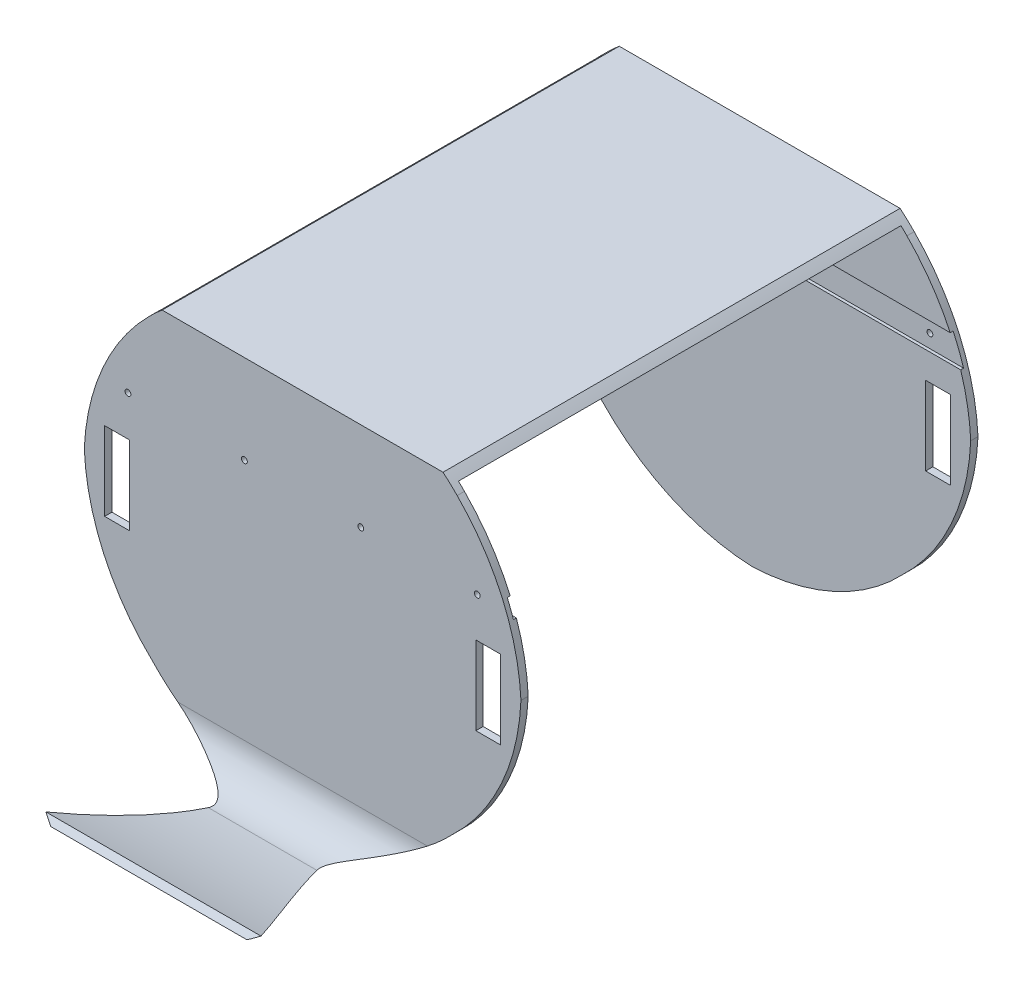
from build123d import *

# Parameters (mm, degrees)
BOSS_EXTRUDE1_DEPTH      = 150
BOSS_EXTRUDE1_DEPTH_BACK = 150
CUT_EXTRUDE1_DEPTH       = 399.19822728
CUT_EXTRUDE1_DEPTH_BACK  = 399.19822728
SKETCH2_OUTSIDE_W        = 417.444
SKETCH2_OUTSIDE_H        = 376.444
CUT_EXTRUDE2_DEPTH       = 399.198227346
CUT_EXTRUDE2_DEPTH_BACK  = 399.198227346
SKETCH3_W                = 4
SKETCH3_H                = 11
SKETCH3_H_2              = 18.5
CUT_EXTRUDE3_DEPTH       = 399.198227346
CUT_EXTRUDE3_DEPTH_BACK  = 399.198227346
SKETCH4_R                = 2
CUT_EXTRUDE4_DEPTH       = 399.198227346
CUT_EXTRUDE4_DEPTH_BACK  = 399.198227346
SKETCH6_W                = 17
SKETCH6_H                = 54


with BuildPart() as part:
    # Sketch1 → Boss-Extrude1 (new, two sides: drawn at the far end of the back side and taken through both)
    with BuildSketch(Plane(origin=(0, 0, 0), x_dir=(0, 0, -1), z_dir=(1, 0, 0)).offset(-BOSS_EXTRUDE1_DEPTH_BACK)):
        with BuildLine():
            Line((-152, 0), (-152, 254))
            Line((-152, 254), (152, 254))
            Line((152, 254), (152, 0))
            Line((152, 0), (157, 0))
            Line((157, 0), (157, 259))
            Line((157, 259), (-157, 259))
            Line((-157, 259), (-157, 31.183582697))
            ThreePointArc((-157, 31.183582697), (-165.22850184, 12.643980503), (-184.497347959, 6.308630372))
            ThreePointArc((-184.497347959, 6.308630372), (-222.45464291, 12.402261203), (-259.428077267, 22.930970935))
            Line((-259.428077267, 22.930970935), (-262.642015315, 19.100748719))
            ThreePointArc((-262.642015315, 19.100748719), (-208.13932257, 4.810245455), (-152, 0))
        make_face()
    extrude(amount=BOSS_EXTRUDE1_DEPTH + BOSS_EXTRUDE1_DEPTH_BACK)

    # Sketch2 outside → Cut-Extrude1 (cut, two sides: drawn at the far end of the back side and taken through both)
    with BuildSketch(Plane.XY.offset(-CUT_EXTRUDE1_DEPTH_BACK)):
        with Locations((0, 129.5)):
            Rectangle(SKETCH2_OUTSIDE_W, SKETCH2_OUTSIDE_H)
        with BuildLine():
            ThreePointArc((-106.180566109, 249.989548857), (-57.545132629, 283.138396945), (0, 295.5))
            ThreePointArc((0, 295.5), (57.545132629, 283.138396945), (106.180566109, 249.989548857))
            ThreePointArc((106.180566109, 249.989548857), (137.347558964, 204.051684319), (150, 150))
            ThreePointArc((150, 150), (136.604447301, 93.873050207), (103.124452968, 46.875547032))
            ThreePointArc((103.124452968, 46.875547032), (56.126949793, 13.395552699), (0, 0))
            ThreePointArc((0, 0), (-56.126949793, 13.395552699), (-103.124452968, 46.875547032))
            ThreePointArc((-103.124452968, 46.875547032), (-136.604447301, 93.873050207), (-150, 150))
            ThreePointArc((-150, 150), (-137.347558964, 204.051684319), (-106.180566109, 249.989548857))
        make_face(mode=Mode.SUBTRACT)
    extrude(amount=CUT_EXTRUDE1_DEPTH + CUT_EXTRUDE1_DEPTH_BACK, mode=Mode.SUBTRACT)

    # Sketch3 → Cut-Extrude2 (cut, two sides: drawn at the far end of the back side and taken through both)
    with BuildSketch(Plane(origin=(0, 0, 0), x_dir=(0, 0, -1), z_dir=(1, 0, 0)).offset(-CUT_EXTRUDE2_DEPTH_BACK)):
        with Locations((-152, 198)):
            Rectangle(SKETCH3_W, SKETCH3_H)
        with Locations((152, 198)):
            Rectangle(SKETCH3_W, SKETCH3_H_2)
    extrude(amount=CUT_EXTRUDE2_DEPTH + CUT_EXTRUDE2_DEPTH_BACK, mode=Mode.SUBTRACT)

    # Sketch4 → Cut-Extrude3 (cut, two sides: drawn at the far end of the back side and taken through both)
    with BuildSketch(Plane.XY.offset(-CUT_EXTRUDE3_DEPTH_BACK)):
        with Locations((-120, 198)):
            Circle(SKETCH4_R)
        with Locations((120, 198)):
            Circle(SKETCH4_R)
        with Locations((40, 198)):
            Circle(SKETCH4_R)
        with Locations((-40, 198)):
            Circle(SKETCH4_R)
    extrude(amount=CUT_EXTRUDE3_DEPTH + CUT_EXTRUDE3_DEPTH_BACK, mode=Mode.SUBTRACT)

    # Sketch6 → Cut-Extrude4 (cut, two sides: drawn at the far end of the back side and taken through both)
    with BuildSketch(Plane.XY.offset(-CUT_EXTRUDE4_DEPTH_BACK)):
        with Locations((-127.5, 143.5)):
            Rectangle(SKETCH6_W, SKETCH6_H)
        with Locations((127.5, 143.5)):
            Rectangle(SKETCH6_W, SKETCH6_H)
    extrude(amount=CUT_EXTRUDE4_DEPTH + CUT_EXTRUDE4_DEPTH_BACK, mode=Mode.SUBTRACT)


solid = part.part
